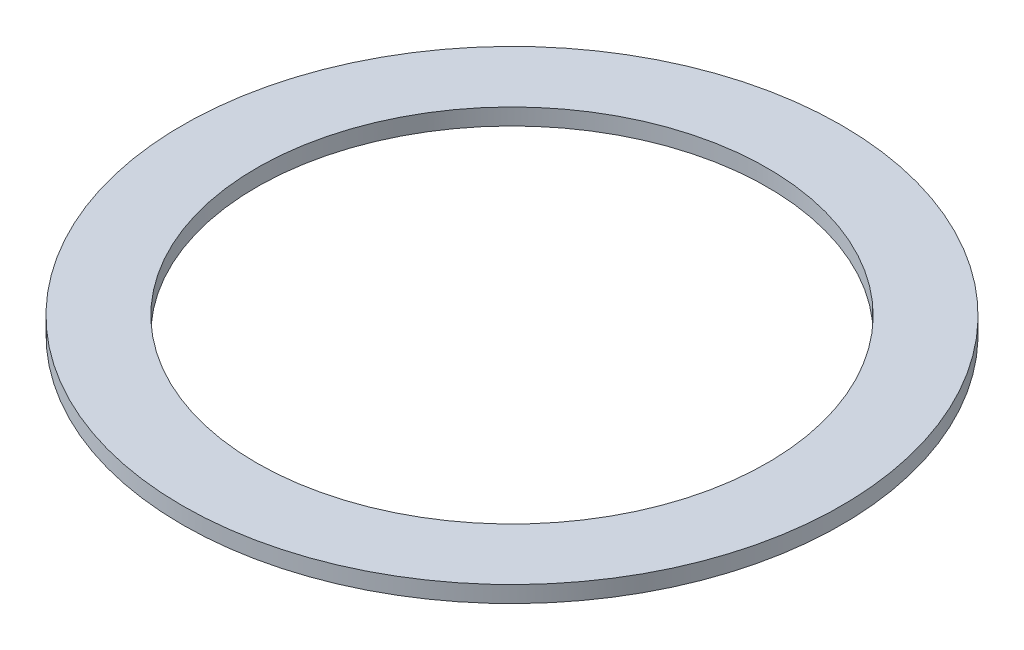
from build123d import *

# Parameters (mm, degrees)
SCHIZZO1_R        = 40
SCHIZZO1_R_2      = 31
ESTRUSIONE1_DEPTH = 2


with BuildPart() as part:
    # Schizzo1 → Estrusione1 (new body)
    with BuildSketch(Plane(origin=(0, 0, 0), x_dir=(1, 0, 0), z_dir=(0, 1, 0))):
        with Locations(Location((0, 0, 0), (0, 0, 270))):
            Circle(SCHIZZO1_R)
        with Locations(Location((0, 0, 0), (0, 0, 270))):
            Circle(SCHIZZO1_R_2, mode=Mode.SUBTRACT)
    extrude(amount=ESTRUSIONE1_DEPTH)


solid = part.part
